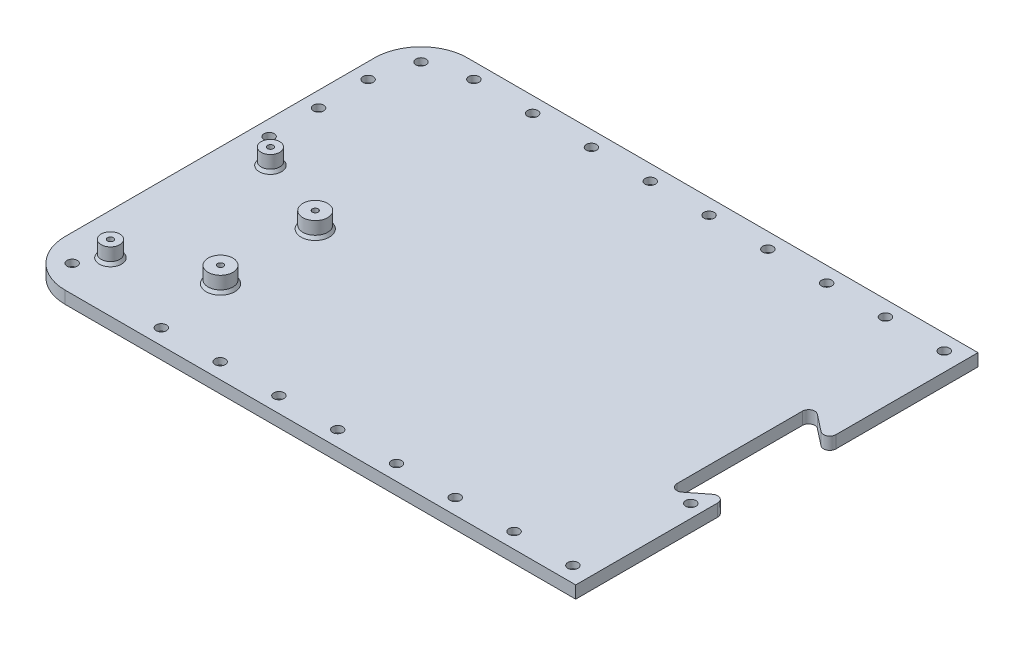
from build123d import *

# Parameters (mm, degrees)
EXTRUDE_1_DEPTH     = 4
SKETCH_2_R          = 1.65
CUT_EXTRUDE_1_DEPTH = 2.1
SKETCH_3_R          = 3
SKETCH_3_R_2        = 4
EXTRUDE_2_DEPTH     = 5.149949226
SKETCH_4_R          = 0.95
CUT_EXTRUDE_2_DEPTH = 5
CHAMFER_1_SIZE      = 0.6
CHAMFER_1_SIZE2     = 1.039230485


with BuildPart() as part:
    # 草图1 → 凸台-拉伸1 (new body)
    with BuildSketch(Plane(origin=(0, 0, 0), x_dir=(1, 0, 0), z_dir=(0, 1, 0))):
        with BuildLine():
            Line((73.808488593, -15.628718768), (68.271134495, -19.954973934))
            ThreePointArc((68.271134495, -19.954973934), (66.16306925, -20.176540519), (65.039811544, -18.378952427))
            Line((65.039811544, -18.378952427), (65.039811544, 22.170687243))
            ThreePointArc((65.039811544, 22.170687243), (66.16306925, 23.968275336), (68.271134495, 23.74670875))
            Line((68.271134495, 23.74670875), (73.808488593, 19.420453584))
            ThreePointArc((73.808488593, 19.420453584), (75.916553838, 19.198886999), (77.039811544, 20.996475091))
            Line((77.039811544, 20.996475091), (77.039811544, 66.895867408))
            Line((77.039811544, 66.895867408), (-87.960188456, 66.895867408))
            ThreePointArc((-87.960188456, 66.895867408), (-98.566790174, 62.502469126), (-102.960188456, 51.895867408))
            Line((-102.960188456, 51.895867408), (-102.960188456, -48.104132592))
            ThreePointArc((-102.960188456, -48.104132592), (-98.566790174, -58.71073431), (-87.960188456, -63.104132592))
            Line((-87.960188456, -63.104132592), (77.039811544, -63.104132592))
            Line((77.039811544, -63.104132592), (77.039811544, -17.204740275))
            ThreePointArc((77.039811544, -17.204740275), (75.916553838, -15.407152182), (73.808488593, -15.628718768))
        make_face()
    extrude(amount=EXTRUDE_1_DEPTH)

    # 草图2 → 切除-拉伸1 (cut)
    with BuildSketch(Plane(origin=(0, 4, 0), x_dir=(1, 0, 0), z_dir=(0, 1, 0))):
        with Locations(Location((72.839811544, -21.715408726, 0), (0, 0, 270))):
            Circle(SKETCH_2_R)
        with Locations(Location((71.125155248, -58.104132592, 0), (0, 0, 270))):
            Circle(SKETCH_2_R)
        with Locations(Location((52.125155248, -58.104132592, 0), (0, 0, 270))):
            Circle(SKETCH_2_R)
        with Locations(Location((33.125155248, -58.104132592, 0), (0, 0, 270))):
            Circle(SKETCH_2_R)
        with Locations(Location((14.125155248, -58.104132592, 0), (0, 0, 270))):
            Circle(SKETCH_2_R)
        with Locations(Location((-4.874844752, -58.104132592, 0), (0, 0, 270))):
            Circle(SKETCH_2_R)
        with Locations(Location((-23.874844752, -58.104132592, 0), (0, 0, 270))):
            Circle(SKETCH_2_R)
        with Locations(Location((-42.874844752, -58.104132592, 0), (0, 0, 270))):
            Circle(SKETCH_2_R)
        with Locations(Location((-61.874844752, -58.104132592, 0), (0, 0, 270))):
            Circle(SKETCH_2_R)
        with Locations(Location((-94.324149487, -54.468093622, 0), (0, 0, 270))):
            Circle(SKETCH_2_R)
        with Locations(Location((-97.960188456, 12.810523704, 0), (0, 0, 270))):
            Circle(SKETCH_2_R)
        with Locations(Location((-97.960188456, 28.810523704, 0), (0, 0, 270))):
            Circle(SKETCH_2_R)
        with Locations(Location((-97.960188456, 44.810523704, 0), (0, 0, 270))):
            Circle(SKETCH_2_R)
        with Locations(Location((-94.324149487, 58.259828439, 0), (0, 0, 270))):
            Circle(SKETCH_2_R)
        with Locations(Location((71.125155248, 61.895867408, 0), (0, 0, 270))):
            Circle(SKETCH_2_R)
        with Locations(Location((52.125155248, 61.895867408, 0), (0, 0, 270))):
            Circle(SKETCH_2_R)
        with Locations(Location((33.125155248, 61.895867408, 0), (0, 0, 270))):
            Circle(SKETCH_2_R)
        with Locations(Location((14.125155248, 61.895867408, 0), (0, 0, 270))):
            Circle(SKETCH_2_R)
        with Locations(Location((-4.874844752, 61.895867408, 0), (0, 0, 270))):
            Circle(SKETCH_2_R)
        with Locations(Location((-23.874844752, 61.895867408, 0), (0, 0, 270))):
            Circle(SKETCH_2_R)
        with Locations(Location((-42.874844752, 61.895867408, 0), (0, 0, 270))):
            Circle(SKETCH_2_R)
        with Locations(Location((-61.874844752, 61.895867408, 0), (0, 0, 270))):
            Circle(SKETCH_2_R)
        with Locations(Location((-80.874844752, 61.895867408, 0), (0, 0, 270))):
            Circle(SKETCH_2_R)
    extrude(amount=-CUT_EXTRUDE_1_DEPTH, mode=Mode.SUBTRACT)

    # 草图3 → 凸台-拉伸2 (add)
    with BuildSketch(Plane(origin=(0, 4, 0), x_dir=(1, 0, 0), z_dir=(0, 1, 0))):
        with Locations((-89.693868923, 4.986273809)):
            Circle(SKETCH_3_R)
        with Locations((-89.693868923, -46.719829823)):
            Circle(SKETCH_3_R)
        with Locations((-64.674818885, -36.171808487)):
            Circle(SKETCH_3_R_2)
        with Locations((-64.674818885, -5.561747527)):
            Circle(SKETCH_3_R_2)
    extrude(amount=EXTRUDE_2_DEPTH)

    # 草图4 → 切除-拉伸2 (cut)
    with BuildSketch(Plane(origin=(0, 9.149949226, 0), x_dir=(1, 0, 0), z_dir=(0, 1, 0))):
        with Locations(Location((-89.693868923, -46.719829823, 0), (0, 0, 180))):
            Circle(SKETCH_4_R)
        with Locations(Location((-64.674818885, -36.171808487, 0), (0, 0, 180))):
            Circle(SKETCH_4_R)
        with Locations(Location((-64.674818885, -5.561747527, 0), (0, 0, 180))):
            Circle(SKETCH_4_R)
        with Locations(Location((-89.693868923, 4.986273809, 0), (0, 0, 180))):
            Circle(SKETCH_4_R)
    extrude(amount=-CUT_EXTRUDE_2_DEPTH, mode=Mode.SUBTRACT)

    # 倒角1
    chamfer_1_edges = [part.edges().sort_by_distance(p)[0] for p in [
        (-92.693868923, 4, -4.986273809),
        (-92.693868923, 4, 46.719829823),
        (-68.674818885, 4, 36.171808487),
        (-68.674818885, 4, 5.561747527),
    ]]
    chamfer_1_side = [part.faces().sort_by_distance(p)[0] for p in [
        (-13.877724131, 4, -2.010371092),
    ]]
    chamfer(chamfer_1_edges, length=CHAMFER_1_SIZE, length2=CHAMFER_1_SIZE2, reference=chamfer_1_side[0])


solid = part.part
